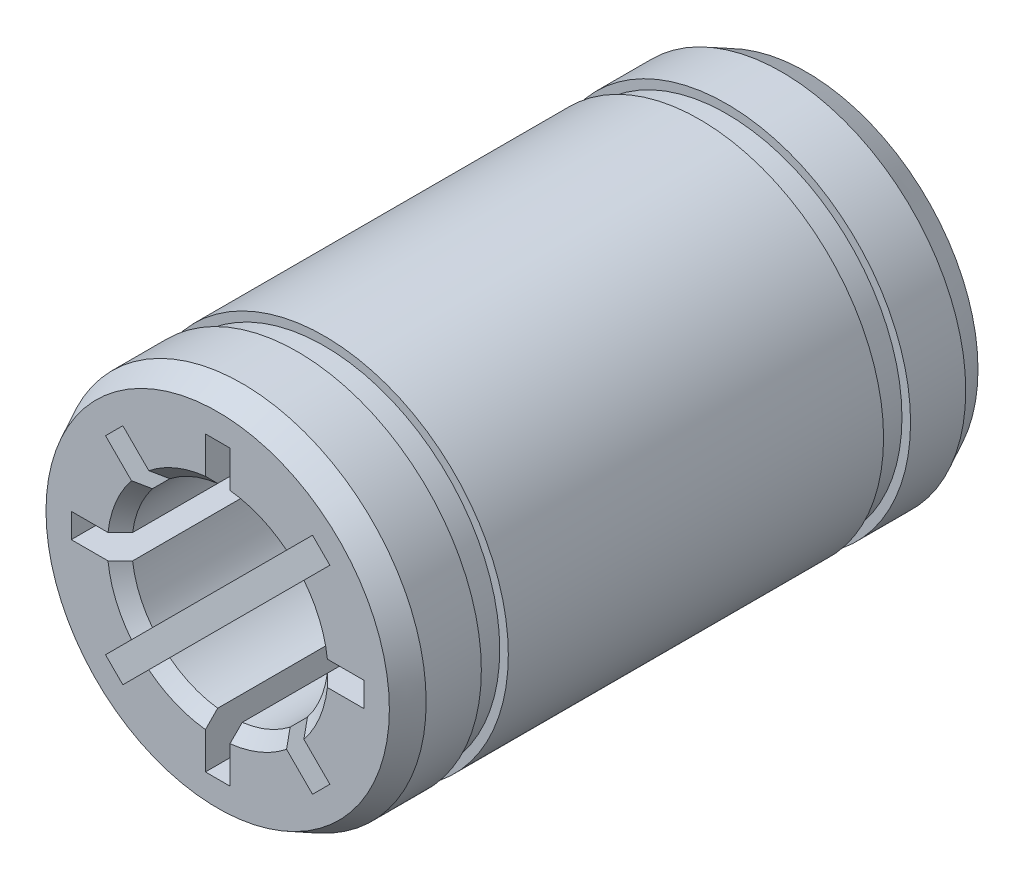
from build123d import *

# Parameters (mm, degrees)
ESQUISSE1_R        = 7.5
BOSS_EXTRU_1_DEPTH = 12
ESQUISSE2_W        = 1.1
ESQUISSE2_H        = 0.35
CHANFREIN1_SIZE    = 1
CHANFREIN1_SIZE2   = 0.5
CHANFREIN2_SIZE    = 0.5
CHANFREIN2_SIZE2   = 1
CHANFREIN3_SIZE    = 0.5


with BuildPart() as part:
    # Esquisse1 → Boss.-Extru.1 (new, symmetric)
    with BuildSketch(Plane.XY):
        Circle(ESQUISSE1_R)
        with BuildLine():
            Line((3.866903212, 4.574009993), (2.452689649, 3.159796431))
            ThreePointArc((2.452689649, 3.159796431), (1.530733729, 3.69551813), (0.5, 3.968626967))
            Line((0.5, 3.968626967), (0.5, 5.968626967))
            Line((0.5, 5.968626967), (-0.5, 5.968626967))
            Line((-0.5, 5.968626967), (-0.5, 3.968626967))
            ThreePointArc((-0.5, 3.968626967), (-1.530733729, 3.69551813), (-2.452689649, 3.159796431))
            Line((-2.452689649, 3.159796431), (-3.866903212, 4.574009993))
            Line((-3.866903212, 4.574009993), (-4.574009993, 3.866903212))
            Line((-4.574009993, 3.866903212), (-3.159796431, 2.452689649))
            ThreePointArc((-3.159796431, 2.452689649), (-3.69551813, 1.530733729), (-3.968626967, 0.5))
            Line((-3.968626967, 0.5), (-5.968626967, 0.5))
            Line((-5.968626967, 0.5), (-5.968626967, -0.5))
            Line((-5.968626967, -0.5), (-3.968626967, -0.5))
            ThreePointArc((-3.968626967, -0.5), (-3.69551813, -1.530733729), (-3.159796431, -2.452689649))
            Line((-3.159796431, -2.452689649), (-4.574009993, -3.866903212))
            Line((-4.574009993, -3.866903212), (-3.866903212, -4.574009993))
            Line((-3.866903212, -4.574009993), (-2.452689649, -3.159796431))
            ThreePointArc((-2.452689649, -3.159796431), (-1.530733729, -3.69551813), (-0.5, -3.968626967))
            Line((-0.5, -3.968626967), (-0.5, -5.968626967))
            Line((-0.5, -5.968626967), (0.5, -5.968626967))
            Line((0.5, -5.968626967), (0.5, -3.968626967))
            ThreePointArc((0.5, -3.968626967), (1.530733729, -3.69551813), (2.452689649, -3.159796431))
            Line((2.452689649, -3.159796431), (3.866903212, -4.574009993))
            Line((3.866903212, -4.574009993), (4.574009993, -3.866903212))
            Line((4.574009993, -3.866903212), (3.159796431, -2.452689649))
            ThreePointArc((3.159796431, -2.452689649), (3.69551813, -1.530733729), (3.968626967, -0.5))
            Line((3.968626967, -0.5), (5.968626967, -0.5))
            Line((5.968626967, -0.5), (5.968626967, 0.5))
            Line((5.968626967, 0.5), (3.968626967, 0.5))
            ThreePointArc((3.968626967, 0.5), (3.69551813, 1.530733729), (3.159796431, 2.452689649))
            Line((3.159796431, 2.452689649), (4.574009993, 3.866903212))
            Line((4.574009993, 3.866903212), (3.866903212, 4.574009993))
        make_face(mode=Mode.SUBTRACT)
    extrude(amount=BOSS_EXTRU_1_DEPTH, both=True)

    # Esquisse2 → Enlèvement de matière-Révolution1 (revolve, cut)
    with BuildSketch(Plane(origin=(0, 0, 0), x_dir=(0, 0, -1), z_dir=(1, 0, 0)), mode=Mode.PRIVATE) as enl_vement_de_mati_re_r_volution1_sk:
        with Locations((-8.2, 7.325)):
            Rectangle(ESQUISSE2_W, ESQUISSE2_H)
        with Locations((8.2, 7.325)):
            Rectangle(ESQUISSE2_W, ESQUISSE2_H)
    revolve(enl_vement_de_mati_re_r_volution1_sk.sketch.rotate(Axis((0, 0, 12), (0, 0, -1)), 90), axis=Axis((0, 0, 12), (0, 0, -1)), mode=Mode.SUBTRACT)

    # Chanfrein1
    chanfrein1_edges = [part.edges().sort_by_distance(p)[0] for p in [
        (-7.5, 0, 12),
    ]]
    chanfrein1_side = [part.faces().sort_by_distance(p)[0] for p in [
        (-7.5, 0, 10.375),
    ]]
    chamfer(chanfrein1_edges, length=CHANFREIN1_SIZE, length2=CHANFREIN1_SIZE2, reference=chanfrein1_side[0])

    # Chanfrein2
    chanfrein2_edges = [part.edges().sort_by_distance(p)[0] for p in [
        (-7.5, 0, -12),
    ]]
    chanfrein2_side = [part.faces().sort_by_distance(p)[0] for p in [
        (-7.287867966, 0, -12),
    ]]
    chamfer(chanfrein2_edges, length=CHANFREIN2_SIZE, length2=CHANFREIN2_SIZE2, reference=chanfrein2_side[0])

    # Chanfrein3
    chanfrein3_edges = [part.edges().sort_by_distance(p)[0] for p in [
        (-1.530733729, 3.69551813, -12),
        (-3.69551813, 1.530733729, -12),
        (-3.69551813, -1.530733729, -12),
        (-1.530733729, -3.69551813, -12),
        (1.530733729, -3.69551813, -12),
        (3.69551813, -1.530733729, -12),
        (3.69551813, 1.530733729, -12),
        (1.530733729, 3.69551813, -12),
        (-1.530733729, 3.69551813, 12),
        (-3.69551813, 1.530733729, 12),
        (-3.69551813, -1.530733729, 12),
        (-1.530733729, -3.69551813, 12),
        (1.530733729, -3.69551813, 12),
        (3.69551813, -1.530733729, 12),
        (3.69551813, 1.530733729, 12),
        (1.530733729, 3.69551813, 12),
    ]]
    chamfer(chanfrein3_edges, length=CHANFREIN3_SIZE)


solid = part.part
